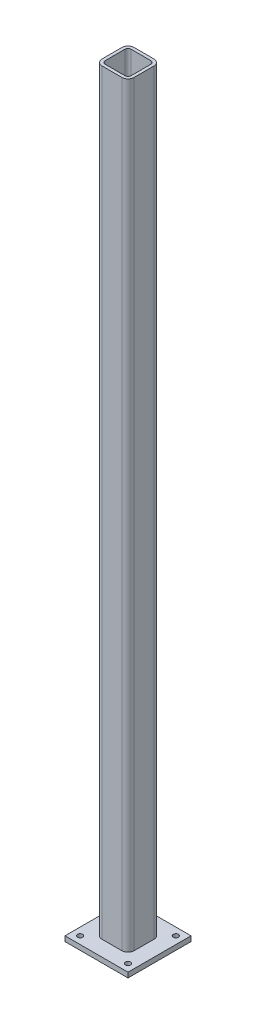
from build123d import *

# Parameters (mm, degrees)
RURA_CIENKO_CIENNA_KWADRATOWA_TS2X2X0_18_DEPTH = 1200
SZKIC4_W                                       = 100
SZKIC4_H                                       = 100
SZKIC4_R                                       = 4.1
DODANIE_WYCI_GNI_CIE1_DEPTH                    = 8


with BuildPart() as part:
    # Sketch12 → Rura cienkościenna kwadratowa TS2X2X0.1875(1) (new body)
    with BuildSketch(Plane(origin=(0, 0, 0), x_dir=(1, 0, 0), z_dir=(0, 1, 0))):
        with BuildLine():
            Line((-15.875, -25.4), (15.875, -25.4))
            ThreePointArc((15.875, -25.4), (22.610192091, -22.610192091), (25.4, -15.875))
            Line((25.4, -15.875), (25.4, 15.875))
            ThreePointArc((25.4, 15.875), (22.610192091, 22.610192091), (15.875, 25.4))
            Line((15.875, 25.4), (-15.875, 25.4))
            ThreePointArc((-15.875, 25.4), (-22.610192091, 22.610192091), (-25.4, 15.875))
            Line((-25.4, 15.875), (-25.4, -15.875))
            ThreePointArc((-25.4, -15.875), (-22.610192091, -22.610192091), (-15.875, -25.4))
        make_face()
        with BuildLine():
            Line((-15.875, -20.6375), (15.875, -20.6375))
            ThreePointArc((15.875, -20.6375), (19.242596045, -19.242596045), (20.6375, -15.875))
            Line((20.6375, -15.875), (20.6375, 15.875))
            ThreePointArc((20.6375, 15.875), (19.242596045, 19.242596045), (15.875, 20.6375))
            Line((15.875, 20.6375), (-15.875, 20.6375))
            ThreePointArc((-15.875, 20.6375), (-19.242596045, 19.242596045), (-20.6375, 15.875))
            Line((-20.6375, 15.875), (-20.6375, -15.875))
            ThreePointArc((-20.6375, -15.875), (-19.242596045, -19.242596045), (-15.875, -20.6375))
        make_face(mode=Mode.SUBTRACT)
    extrude(amount=RURA_CIENKO_CIENNA_KWADRATOWA_TS2X2X0_18_DEPTH)


with BuildPart() as body_2:
    # Szkic4 → Dodanie-wyciągnięcie1 (new body)
    with BuildSketch(Plane(origin=(0, 0, 0), x_dir=(-1, 0, 0), z_dir=(0, -1, 0))):
        Rectangle(SZKIC4_W, SZKIC4_H)
        with Locations(Location((38, -38, 0), (0, 0, 90))):
            Circle(SZKIC4_R, mode=Mode.SUBTRACT)
        with Locations(Location((-38, -38, 0), (0, 0, 90))):
            Circle(SZKIC4_R, mode=Mode.SUBTRACT)
        with Locations(Location((-38, 38, 0), (0, 0, 90))):
            Circle(SZKIC4_R, mode=Mode.SUBTRACT)
        with Locations(Location((38, 38, 0), (0, 0, 90))):
            Circle(SZKIC4_R, mode=Mode.SUBTRACT)
    extrude(amount=DODANIE_WYCI_GNI_CIE1_DEPTH)


solid = Compound([part.part, body_2.part])
